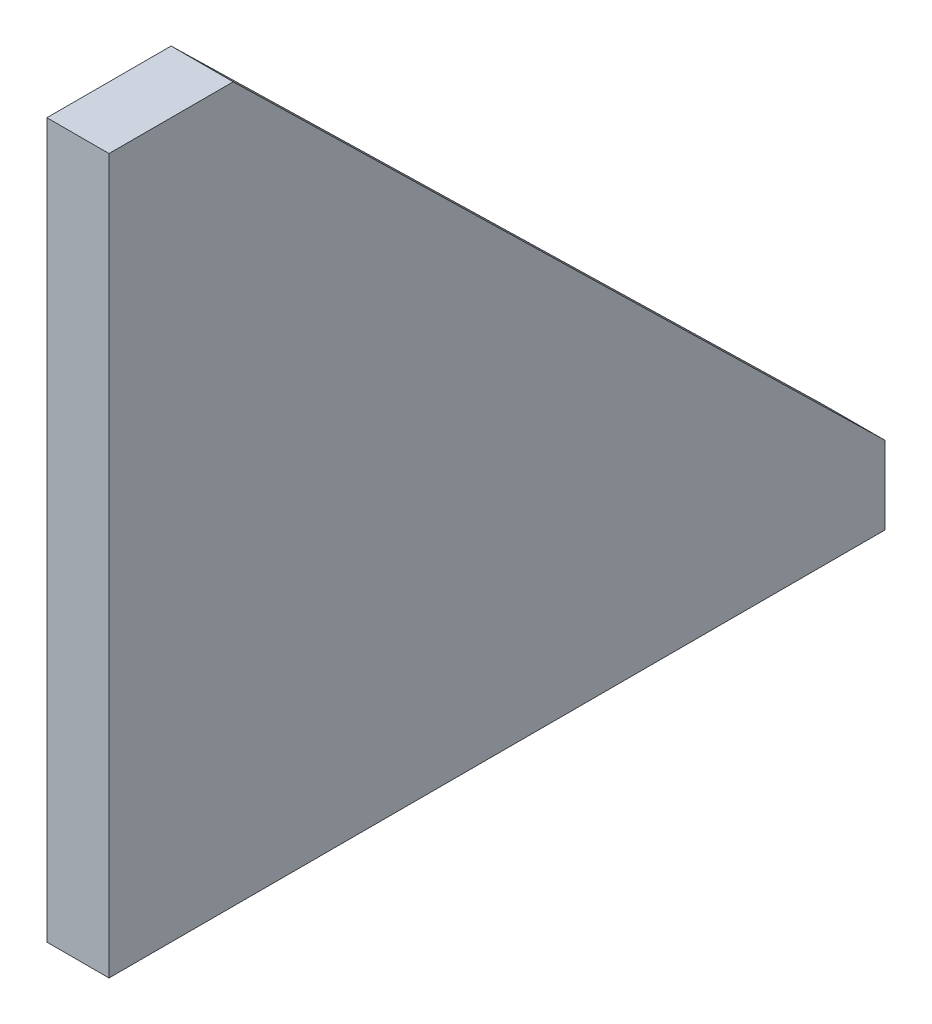
from build123d import *

# Parameters (mm, degrees)
BOSS_EXTRUDE1_DEPTH = 20


with BuildPart() as part:
    # Sketch1 → Boss-Extrude1 (new body)
    with BuildSketch(Plane(origin=(0, 0, 0), x_dir=(0, 0, -1), z_dir=(1, 0, 0))):
        Polygon((-85, 115), (125, -90), (125, -115), (-125, -115), (-125, 115), align=None)
    extrude(amount=BOSS_EXTRUDE1_DEPTH)


solid = part.part
